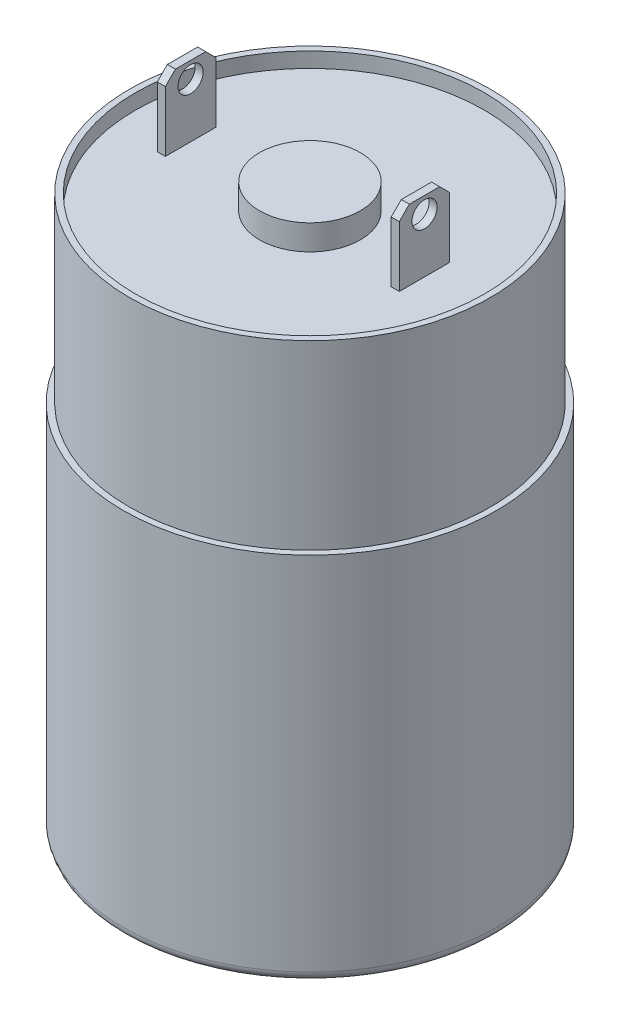
from build123d import *

# Parameters (mm, degrees)
CROQUIS1_R                = 18.5
SALIENTE_EXTRUIR1_DEPTH   = 18.4
CROQUIS2_R                = 17.9
SALIENTE_EXTRUIR2_DEPTH   = 18
CROQUIS3_R                = 17.3
CORTAR_EXTRUIR1_DEPTH     = 1.5
CROQUIS4_R                = 5
SALIENTE_EXTRUIR3_DEPTH   = 2.5
CROQUIS5_W                = 0.8
CROQUIS5_H                = 5
SALIENTE_EXTRUIR4_DEPTH   = 7
CHAFL_N1_SIZE             = 1
CHAFL_N2_SIZE             = 1
CROQUIS6_R                = 1.25
CORTAR_EXTRUIR2_DEPTH     = 7
MATRIZL1_COUNT            = 2
MATRIZL1_PITCH            = 23.2
CHAFL_N1_OF_MATRIZL1_SIZE = 1
CHAFL_N2_OF_MATRIZL1_SIZE = 1
REDONDEO1_R               = 1


with BuildPart() as part:
    # Croquis1 → Saliente-Extruir1 (new, symmetric)
    with BuildSketch(Plane(origin=(0, 0, 0), x_dir=(1, 0, 0), z_dir=(0, 1, 0))):
        with Locations(Location((0, 0, 0), (0, 0, 270))):
            Circle(CROQUIS1_R)
    extrude(amount=SALIENTE_EXTRUIR1_DEPTH, both=True)

    # Croquis2 → Saliente-Extruir2 (add)
    with BuildSketch(Plane(origin=(0, 18.4, 0), x_dir=(1, 0, 0), z_dir=(0, 1, 0))):
        with Locations(Location((0, 0, 0), (0, 0, 270))):
            Circle(CROQUIS2_R)
    extrude(amount=SALIENTE_EXTRUIR2_DEPTH)

    # Croquis3 → Cortar-Extruir1 (cut)
    with BuildSketch(Plane(origin=(0, 36.4, 0), x_dir=(1, 0, 0), z_dir=(0, 1, 0))):
        with Locations(Location((0, 0, 0), (0, 0, 270))):
            Circle(CROQUIS3_R)
    extrude(amount=-CORTAR_EXTRUIR1_DEPTH, mode=Mode.SUBTRACT)

    # Croquis4 → Saliente-Extruir3 (add)
    with BuildSketch(Plane(origin=(0, 34.9, 0), x_dir=(1, 0, 0), z_dir=(0, 1, 0))):
        with Locations(Location((0, 0, 0), (0, 0, 270))):
            Circle(CROQUIS4_R)
    extrude(amount=SALIENTE_EXTRUIR3_DEPTH)

    # Croquis5 → Saliente-Extruir4 (add)
    with BuildSketch(Plane(origin=(0, 34.9, 0), x_dir=(1, 0, 0), z_dir=(0, 1, 0))):
        with Locations((-12.23891887, 0)):
            Rectangle(CROQUIS5_W, CROQUIS5_H)
    saliente_extruir4 = extrude(amount=SALIENTE_EXTRUIR4_DEPTH)

    # Chaflán1
    chafl_n1_edges = [part.edges().sort_by_distance(p)[0] for p in [
        (-12.23891887, 41.9, 2.5),
    ]]
    chamfer(chafl_n1_edges, length=CHAFL_N1_SIZE)

    # Chaflán2
    chafl_n2_edges = [part.edges().sort_by_distance(p)[0] for p in [
        (-12.23891887, 41.9, -2.5),
    ]]
    chamfer(chafl_n2_edges, length=CHAFL_N2_SIZE)

    # Croquis6 → Cortar-Extruir2 (cut)
    with BuildSketch(Plane(origin=(-11.83891887, 0, 0), x_dir=(0, 0, -1), z_dir=(1, 0, 0))):
        with Locations((0, 40.285474099)):
            Circle(CROQUIS6_R)
    cortar_extruir2 = extrude(amount=-CORTAR_EXTRUIR2_DEPTH, mode=Mode.SUBTRACT)

    # MatrizL1: Saliente-Extruir4, Cortar-Extruir2 ×2
    with Locations(*[(i * MATRIZL1_PITCH, 0, 0) for i in range(1, MATRIZL1_COUNT)]):
        add(saliente_extruir4)
        add(cortar_extruir2, mode=Mode.SUBTRACT)

    # Chaflán1 of MatrizL1
    chafl_n1_of_matrizl1_edges = [part.edges().sort_by_distance(p)[0] for p in [
        (10.96108113, 41.9, 2.5),
    ]]
    chamfer(chafl_n1_of_matrizl1_edges, length=CHAFL_N1_OF_MATRIZL1_SIZE)

    # Chaflán2 of MatrizL1
    chafl_n2_of_matrizl1_edges = [part.edges().sort_by_distance(p)[0] for p in [
        (10.96108113, 41.9, -2.5),
    ]]
    chamfer(chafl_n2_of_matrizl1_edges, length=CHAFL_N2_OF_MATRIZL1_SIZE)

    # Redondeo1
    redondeo1_edges = [part.edges().sort_by_distance(p)[0] for p in [
        (0, -18.4, -18.5),
    ]]
    fillet(redondeo1_edges, radius=REDONDEO1_R)


solid = part.part
